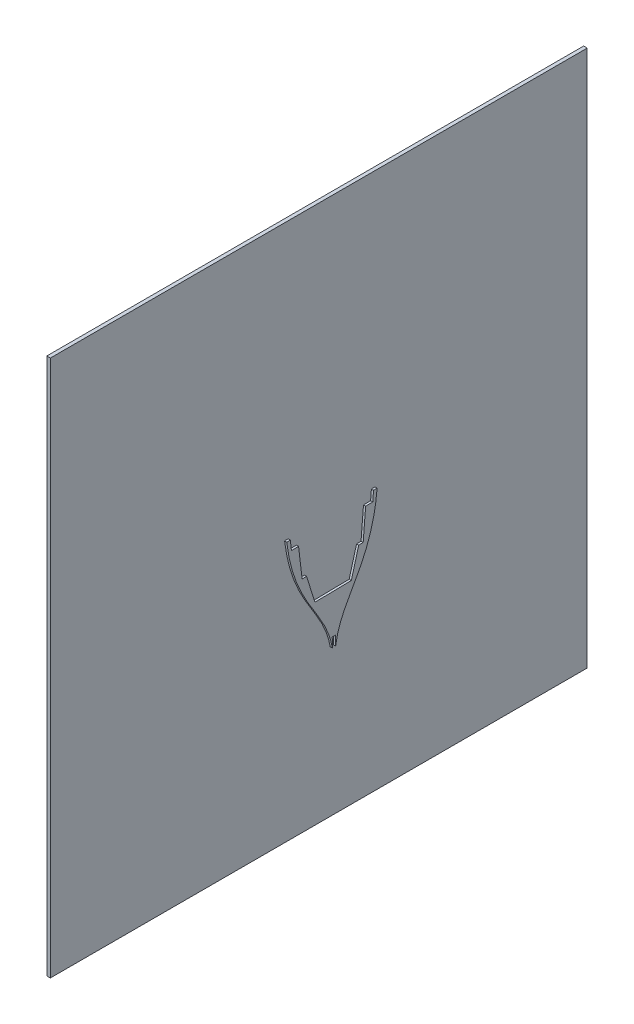
from build123d import *

# Parameters (mm, degrees)
BOSS_EXTRU_2_DEPTH      = 10
BOSS_EXTRU_3_DEPTH      = 6
ENL_V_MAT_EXTRU_1_DEPTH = 6


with BuildPart() as part:
    # Esquisse3D1 → Boss.-Extru.2 (new body)
    with BuildSketch(Plane(origin=(-20, 1121.289346724, 777.274991403), x_dir=(0, -0.7071067811865476, -0.7071067811865476), z_dir=(1, 0, 0))):
        Polygon((0, 0), (1060.66017178, 1060.66017178), (2121.32034356, 0), (1060.66017178, -1060.66017178), align=None)
    extrude(amount=BOSS_EXTRU_2_DEPTH)


with BuildPart() as body_2:
    # Esquisse5 → Boss.-Extru.3 (new body)
    with BuildSketch(Plane(origin=(0, 0, 0), x_dir=(0, 0, -1), z_dir=(1, 0, 0))):
        with BuildLine():
            Line((119.650611997, 366.176077392), (109.650611997, 365.994923619))
            Line((109.650611997, 365.994923619), (107.515068423, 338.792154681))
            Line((107.515068423, 338.792154681), (87.583504737, 338.431086885))
            Line((87.583504737, 338.431086885), (80.73903739, 254.0838692))
            Line((80.73903739, 254.0838692), (68.268721406, 253.857964722))
            Line((68.268721406, 253.857964722), (47.655280024, 178.721523841))
            Line((47.655280024, 178.721523841), (-54.097103916, 176.87824102))
            Line((-54.097103916, 176.87824102), (-77.418377324, 251.218787967))
            Line((-77.418377324, 251.218787967), (-89.888693308, 250.992883489))
            Line((-89.888693308, 250.992883489), (-99.783630674, 335.036860542))
            Line((-99.783630674, 335.036860542), (-119.71519436, 334.675792746))
            Line((-119.71519436, 334.675792746), (-122.834590281, 361.783366473))
            Line((-122.834590281, 361.783366473), (-132.834590281, 361.602212701))
            add(Edge.make_bspline(
                [(0, 0), (-5.906531601, 58.21265899), (-10.646353721, 142.634498604), (-108.956470004, 164.351037203), (-132.834590281, 361.602212701)],
                knots=[0, 0, 0, 0, 0, 1, 1, 1, 1, 1], degree=4))
            add(Edge.make_bspline(
                [(0, 0), (3.794259566, 58.388392481), (5.473308278, 142.926512363), (102.932373018, 168.18948353), (119.650611997, 366.176077392)],
                knots=[0, 0, 0, 0, 0, 1, 1, 1, 1, 1], degree=4))
        make_face()
    extrude(amount=BOSS_EXTRU_3_DEPTH)

    # Esquisse6 → Enlèv. mat.-Extru.1 (cut)
    with BuildSketch(Plane(origin=(6, 0, 0), x_dir=(0, 0, -1), z_dir=(1, 0, 0))):
        Polygon((-5.25437166, 41.561094688), (-5.743486846, 68.561094688), (3.256513154, 68.724133083), (3.74562834, 41.724133083), (117.063261114, -47.52702125), (-85.227699586, -65.220017949), align=None)
    extrude(amount=-ENL_V_MAT_EXTRU_1_DEPTH, mode=Mode.SUBTRACT)


solid = Compound([part.part, body_2.part])
